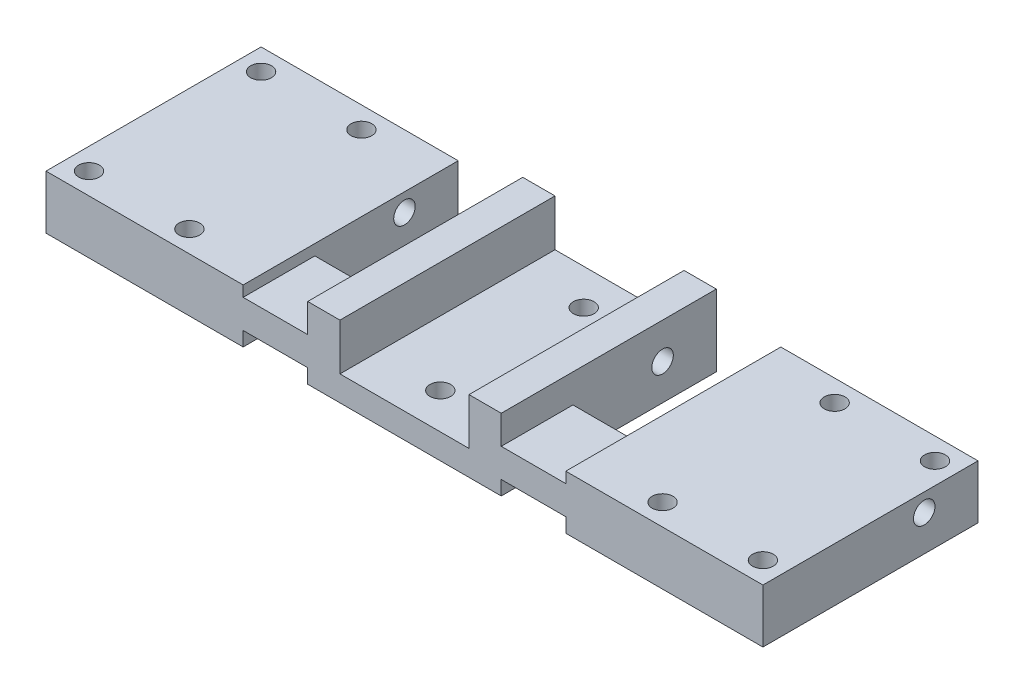
from build123d import *

# Parameters (mm, degrees)
SKETCH_1_W           = 100
SKETCH_1_H           = 30
SKETCH_1_R           = 1.45
EXTRUDE_1_DEPTH      = 10
SKETCH_2_W           = 24
SKETCH_2_H           = 30
CUT_EXTRUDE_1_DEPTH  = 6.5
SKETCH_3_W           = 9
SKETCH_3_H           = 15
CUT_EXTRUDE_2_DEPTH  = 16.5
SKETCH_4_W           = 9
SKETCH_4_H           = 4
CUT_EXTRUDE_3_DEPTH  = 16.5
SKETCH_6_R           = 1.5
CUT_EXTRUDE_4_DEPTH  = 16
CUT_EXTRUDE_START    = -8
SKETCH_7_R           = 1.5
CUT_EXTRUDE_5_DEPTH  = 8
CHAMFER_1_SIZE       = 5
CUT_EXTRUDE_START_2  = -30
SKETCH_10_R          = 1.5
CUT_EXTRUDE_8_DEPTH  = 30
SKETCH_11_R          = 1.5
CUT_EXTRUDE_9_DEPTH  = 30
SKETCH_15_W          = 27.5
SKETCH_15_H          = 2.5
CUT_EXTRUDE_14_DEPTH = 30
CUT_EXTRUDE_15_REACH = 106.881
SKETCH_16_W          = 9
SKETCH_16_H          = 2
SKETCH_19_R          = 1.45
CUT_EXTRUDE_18_DEPTH = 105.880884817
SKETCH_21_W          = 30
SKETCH_21_H          = 6.5
EXTRUDE_2_DEPTH      = 3
CUT_EXTRUDE_START_3  = -2
SKETCH_22_R          = 1.5
CUT_EXTRUDE_19_DEPTH = 2
SKETCH_23_W          = 30
SKETCH_23_H          = 6.5
EXTRUDE_3_DEPTH      = 3
SKETCH_24_R          = 1.5
CUT_EXTRUDE_20_DEPTH = 2


with BuildPart() as part:
    # 草图1 → 凸台-拉伸1 (new body)
    with BuildSketch(Plane(origin=(0, 0, 0), x_dir=(1, 0, 0), z_dir=(0, 1, 0))):
        with Locations((-50, 15)):
            Rectangle(SKETCH_1_W, SKETCH_1_H)
        with Locations(Location((-50, 25, 0), (0, 0, 270))):
            Circle(SKETCH_1_R, mode=Mode.SUBTRACT)
        with Locations(Location((-50, 5, 0), (0, 0, 270))):
            Circle(SKETCH_1_R, mode=Mode.SUBTRACT)
    extrude(amount=EXTRUDE_1_DEPTH)

    # 草图2 → 切除-拉伸1 (cut)
    with BuildSketch(Plane(origin=(0, 10, 0), x_dir=(1, 0, 0), z_dir=(0, 1, 0))):
        with Locations((-50, 15)):
            Rectangle(SKETCH_2_W, SKETCH_2_H)
    extrude(amount=-CUT_EXTRUDE_1_DEPTH, mode=Mode.SUBTRACT)

    # 草图3 → 切除-拉伸2 (cut)
    with BuildSketch(Plane(origin=(0, 10, 0), x_dir=(1, 0, 0), z_dir=(0, 1, 0))):
        with Locations((-68, 22.5)):
            Rectangle(SKETCH_3_W, SKETCH_3_H)
        with Locations((-32, 22.5)):
            Rectangle(SKETCH_3_W, SKETCH_3_H)
    extrude(amount=-CUT_EXTRUDE_2_DEPTH, mode=Mode.SUBTRACT)

    # 草图4 → 切除-拉伸3 (cut)
    with BuildSketch(Plane(origin=(0, 0, -15), x_dir=(-1, 0, 0), z_dir=(0, 0, -1))):
        with Locations((68, 8)):
            Rectangle(SKETCH_4_W, SKETCH_4_H)
        with Locations((32, 8)):
            Rectangle(SKETCH_4_W, SKETCH_4_H)
    extrude(amount=-CUT_EXTRUDE_3_DEPTH, mode=Mode.SUBTRACT)

    # 草图6 → 切除-拉伸4 (cut)
    with BuildSketch(Plane(origin=(-62, 0, 0), x_dir=(0, 0, -1), z_dir=(1, 0, 0))):
        with Locations((22.5, 5)):
            Circle(SKETCH_6_R)
    extrude(amount=-CUT_EXTRUDE_4_DEPTH, mode=Mode.SUBTRACT)

    # 草图7 → 切除-拉伸5 (cut)
    with BuildSketch(Plane.ZY.offset(38).offset(CUT_EXTRUDE_START)):
        with Locations(Location((-22.5, 5, 0), (0, 0, 180))):
            Circle(SKETCH_7_R)
    extrude(amount=CUT_EXTRUDE_5_DEPTH, mode=Mode.SUBTRACT)

    # 倒角1
    chamfer_1_edges = [part.edges().sort_by_distance(p)[0] for p in [
        (-32, 6, -15),
        (-68, 6, -15),
    ]]
    chamfer(chamfer_1_edges, length=CHAMFER_1_SIZE)

    # 草图10 → 切除-拉伸8 (cut)
    with BuildSketch(Plane(origin=(-100, -149.284504662, 244.723777946), x_dir=(0, 0, 1), z_dir=(-1, 0, 0)).offset(CUT_EXTRUDE_START_2)):
        with Locations(Location((-267.223777946, 154.284504662, 0), (0, 0, 180))):
            Circle(SKETCH_10_R)
    extrude(amount=CUT_EXTRUDE_8_DEPTH, mode=Mode.SUBTRACT)

    # 草图11 → 切除-拉伸9 (cut)
    with BuildSketch(Plane(origin=(0, -149.284504662, 244.723777946), x_dir=(0, 0, -1), z_dir=(1, 0, 0))):
        with Locations((267.223777946, 154.284504662)):
            Circle(SKETCH_11_R)
    extrude(amount=-CUT_EXTRUDE_9_DEPTH, mode=Mode.SUBTRACT)

    # 草图15 → 切除-拉伸14 (cut)
    with BuildSketch(Plane(origin=(0, 0, -30), x_dir=(-1, 0, 0), z_dir=(0, 0, -1))):
        with Locations((13.75, 8.75)):
            Rectangle(SKETCH_15_W, SKETCH_15_H)
        with Locations((86.25, 8.75)):
            Rectangle(SKETCH_15_W, SKETCH_15_H)
    extrude(amount=-CUT_EXTRUDE_14_DEPTH, mode=Mode.SUBTRACT)

    # 切除-拉伸15: up to this plane
    cut_extrude_15_end = Plane(origin=(-63.5, 6, -10), z_dir=(0, -0.7071067811865456, 0.7071067811865495))
    # 草图16 → 切除-拉伸15 (cut, up to the surface)
    with BuildSketch(Plane.XY, mode=Mode.PRIVATE) as cut_extrude_15_sk1:
        with Locations((-68, 1)):
            Rectangle(SKETCH_16_W, SKETCH_16_H)
    cut_extrude_15_tool1 = split(extrude(cut_extrude_15_sk1.sketch, amount=-CUT_EXTRUDE_15_REACH, mode=Mode.PRIVATE), bisect_by=cut_extrude_15_end, keep=Keep.BOTH, mode=Mode.PRIVATE)
    add(cut_extrude_15_tool1.solids().sort_by_distance((-68, 1, 0))[0], mode=Mode.SUBTRACT)
    # 草图16 → 切除-拉伸15 (cut, up to the surface)
    with BuildSketch(Plane.XY, mode=Mode.PRIVATE) as cut_extrude_15_sk2:
        with Locations((-32, 1)):
            Rectangle(SKETCH_16_W, SKETCH_16_H)
    cut_extrude_15_tool2 = split(extrude(cut_extrude_15_sk2.sketch, amount=-CUT_EXTRUDE_15_REACH, mode=Mode.PRIVATE), bisect_by=cut_extrude_15_end, keep=Keep.BOTH, mode=Mode.PRIVATE)
    add(cut_extrude_15_tool2.solids().sort_by_distance((-32, 1, 0))[0], mode=Mode.SUBTRACT)

    # 草图19 → 切除-拉伸18 (cut, through all)
    with BuildSketch(Plane.XZ):
        with Locations(Location((-3, -3, 0), (0, 0, 270))):
            Circle(SKETCH_19_R)
        with Locations(Location((-17, -3, 0), (0, 0, 270))):
            Circle(SKETCH_19_R)
        with Locations(Location((-17, -27, 0), (0, 0, 270))):
            Circle(SKETCH_19_R)
        with Locations(Location((-3, -27, 0), (0, 0, 270))):
            Circle(SKETCH_19_R)
        with Locations((-97, -27)):
            Circle(SKETCH_19_R)
        with Locations((-83, -27)):
            Circle(SKETCH_19_R)
        with Locations((-83, -3)):
            Circle(SKETCH_19_R)
        with Locations((-97, -3)):
            Circle(SKETCH_19_R)
    extrude(amount=-CUT_EXTRUDE_18_DEPTH, mode=Mode.SUBTRACT)

    # 草图21 → 凸台-拉伸2 (add)
    with BuildSketch(Plane(origin=(-62, 0, 0), x_dir=(0, 0, -1), z_dir=(1, 0, 0))):
        with Locations((15, 6.75)):
            Rectangle(SKETCH_21_W, SKETCH_21_H)
    extrude(amount=EXTRUDE_2_DEPTH)

    # 草图22 → 切除-拉伸19 (cut)
    with BuildSketch(Plane.ZY.offset(62).offset(CUT_EXTRUDE_START_3)):
        with Locations(Location((-22.5, 5, 0), (0, 0, 180))):
            Circle(SKETCH_22_R)
    extrude(amount=CUT_EXTRUDE_19_DEPTH, mode=Mode.SUBTRACT)

    # 草图23 → 凸台-拉伸3 (add)
    with BuildSketch(Plane.ZY.offset(38)):
        with Locations((-15, 6.75)):
            Rectangle(SKETCH_23_W, SKETCH_23_H)
    extrude(amount=EXTRUDE_3_DEPTH)

    # 草图24 → 切除-拉伸20 (cut)
    with BuildSketch(Plane(origin=(-38, 0, 0), x_dir=(0, 0, -1), z_dir=(1, 0, 0))):
        with Locations((22.5, 5)):
            Circle(SKETCH_24_R)
    extrude(amount=-CUT_EXTRUDE_20_DEPTH, mode=Mode.SUBTRACT)


solid = part.part
